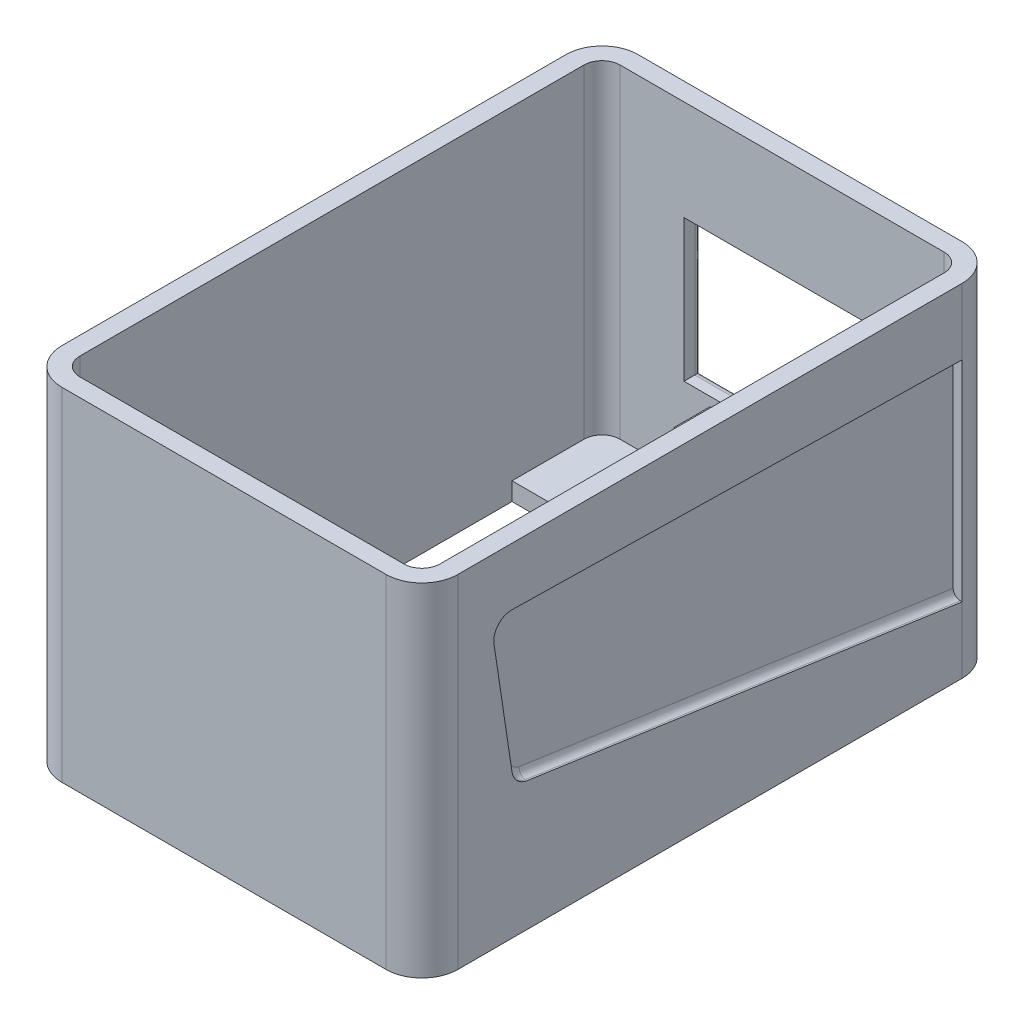
from build123d import *

# Parameters (mm, degrees)
BOSS_EXTRUDE1_DEPTH = 6.35
BOSS_EXTRUDE2_DEPTH = 114.3
SKETCH3_W           = 69.2
SKETCH3_H           = 50
CUT_EXTRUDE1_DEPTH  = 31.71
FILLET1_R           = 2.54
CUT_EXTRUDE2_DEPTH  = 3.175
FILLET2_R           = 2.54
SKETCH8_W           = 50.8
SKETCH8_H           = 6.35
BOSS_EXTRUDE3_DEPTH = 12.7
SKETCH9_W           = 27.302002056
SKETCH9_H           = 3.175
BOSS_EXTRUDE4_DEPTH = 6.35
FILLET4_R           = 2.54
FILLET5_R           = 2.54


with BuildPart() as part:
    # Sketch1 → Boss-Extrude1 (new body)
    with BuildSketch(Plane(origin=(0, 0, 0), x_dir=(1, 0, 0), z_dir=(0, 1, 0))):
        with BuildLine():
            Line((-51.097477477, 62.55608588), (63.202522523, 62.55608588))
            ThreePointArc((63.202522523, 62.55608588), (72.182778644, 58.836342002), (75.902522523, 49.85608588))
            Line((75.902522523, 49.85608588), (75.902522523, -127.94391412))
            ThreePointArc((75.902522523, -127.94391412), (72.182778644, -136.924170241), (63.202522523, -140.64391412))
            Line((63.202522523, -140.64391412), (-51.097477477, -140.64391412))
            ThreePointArc((-51.097477477, -140.64391412), (-60.077733599, -136.924170241), (-63.797477477, -127.94391412))
            Line((-63.797477477, -127.94391412), (-63.797477477, 49.85608588))
            ThreePointArc((-63.797477477, 49.85608588), (-60.077733599, 58.836342002), (-51.097477477, 62.55608588))
        make_face()
        Polygon((-57.447477477, 24.45608588), (-57.447477477, -102.54391412), (-19.347477477, -102.54391412), (-19.347477477, -134.29391412), (31.452522523, -134.29391412), (31.452522523, -102.54391412), (69.552522523, -102.54391412), (69.552522523, 24.45608588), (31.452522523, 24.45608588), (31.452522523, 56.20608588), (-19.347477477, 56.20608588), (-19.347477477, 24.45608588), align=None, mode=Mode.SUBTRACT)
    extrude(amount=BOSS_EXTRUDE1_DEPTH)

    # Sketch2 → Boss-Extrude2 (add)
    with BuildSketch(Plane(origin=(0, 6.35, 0), x_dir=(1, 0, 0), z_dir=(0, 1, 0))):
        with BuildLine():
            Line((75.902522523, -127.94391412), (75.902522523, 49.85608588))
            ThreePointArc((75.902522523, 49.85608588), (72.182778644, 58.836342002), (63.202522523, 62.55608588))
            Line((63.202522523, 62.55608588), (-51.097477477, 62.55608588))
            ThreePointArc((-51.097477477, 62.55608588), (-60.077733599, 58.836342002), (-63.797477477, 49.85608588))
            Line((-63.797477477, 49.85608588), (-63.797477477, -127.94391412))
            ThreePointArc((-63.797477477, -127.94391412), (-60.077733599, -136.924170241), (-51.097477477, -140.64391412))
            Line((-51.097477477, -140.64391412), (63.202522523, -140.64391412))
            ThreePointArc((63.202522523, -140.64391412), (72.182778644, -136.924170241), (75.902522523, -127.94391412))
        make_face()
        with BuildLine():
            Line((69.552522523, -127.94391412), (69.552522523, 49.85608588))
            ThreePointArc((69.552522523, 49.85608588), (67.692650583, 54.346213941), (63.202522523, 56.20608588))
            Line((63.202522523, 56.20608588), (-51.097477477, 56.20608588))
            ThreePointArc((-51.097477477, 56.20608588), (-55.587605538, 54.346213941), (-57.447477477, 49.85608588))
            Line((-57.447477477, 49.85608588), (-57.447477477, -127.94391412))
            ThreePointArc((-57.447477477, -127.94391412), (-55.587605538, -132.43404218), (-51.097477477, -134.29391412))
            Line((-51.097477477, -134.29391412), (63.202522523, -134.29391412))
            ThreePointArc((63.202522523, -134.29391412), (67.692650583, -132.43404218), (69.552522523, -127.94391412))
        make_face(mode=Mode.SUBTRACT)
    extrude(amount=BOSS_EXTRUDE2_DEPTH)

    # Sketch3 → Cut-Extrude1 (cut)
    with BuildSketch(Plane(origin=(0, 0, -62.55608588), x_dir=(-1, 0, 0), z_dir=(0, 0, -1))):
        with Locations((-6.052522523, 60.325)):
            Rectangle(SKETCH3_W, SKETCH3_H)
    extrude(amount=-CUT_EXTRUDE1_DEPTH, mode=Mode.SUBTRACT)

    # Fillet1
    fillet1_edges = [part.edges().sort_by_distance(p)[0] for p in [
        (6.052522523, 85.325, -62.55608588),
        (-28.547477477, 60.325, -62.55608588),
        (40.652522523, 60.325, -62.55608588),
        (6.052522523, 35.325, -62.55608588),
    ]]
    fillet(fillet1_edges, radius=FILLET1_R)

    # Sketch6 → Cut-Extrude2 (cut)
    with BuildSketch(Plane.ZY.offset(63.797477477)):
        with BuildLine():
            Line((-49.85608588, 23.368), (103.519740541, 45.45891847))
            ThreePointArc((103.519740541, 45.45891847), (107.09072322, 47.24008694), (108.89391412, 50.8))
            Line((108.89391412, 50.8), (115.24391412, 93.037110429))
            ThreePointArc((115.24391412, 93.037110429), (113.736824756, 98.170115624), (108.842546446, 100.33))
            Line((108.842546446, 100.33), (-49.85608588, 97.282))
            Line((-49.85608588, 97.282), (-49.85608588, 23.368))
        make_face()
    cut_extrude2 = extrude(amount=-CUT_EXTRUDE2_DEPTH, mode=Mode.SUBTRACT)

    # Fillet2
    fillet2_edges = [part.edges().sort_by_distance(p)[0] for p in [
        (-60.622477477, 98.170115624, 113.736824756),
        (-60.622477477, 71.918555214, 112.06891412),
        (-60.622477477, 47.24008694, 107.09072322),
        (-60.622477477, 34.413459235, 26.83182733),
        (-60.622477477, 60.325, -49.85608588),
        (-60.622477477, 98.806, 29.493230283),
    ]]
    fillet(fillet2_edges, radius=FILLET2_R)

    # Sketch8 → Boss-Extrude3 (add)
    with BuildSketch(Plane.XY.offset(-56.20608588)):
        with Locations((6.052522523, 28.975)):
            Rectangle(SKETCH8_W, SKETCH8_H)
    extrude(amount=BOSS_EXTRUDE3_DEPTH)

    # Sketch9 → Boss-Extrude4 (add)
    with BuildSketch(Plane(origin=(0, 32.15, 0), x_dir=(1, 0, 0), z_dir=(0, 1, 0))):
        with Locations((17.801521495, 45.09358588)):
            Rectangle(SKETCH9_W, SKETCH9_H)
    extrude(amount=BOSS_EXTRUDE4_DEPTH)

    # Fillet4
    fillet4_edges = [part.edges().sort_by_distance(p)[0] for p in [
        (6.052522523, 25.8, -56.20608588),
    ]]
    fillet(fillet4_edges, radius=FILLET4_R)

    # Mirror2: Cut-Extrude2 across plane
    add(cut_extrude2.mirror(Plane(origin=(6.052522523, 0, 0), x_dir=(0, 0, 1), z_dir=(1, 0, 0))), mode=Mode.SUBTRACT)

    # Fillet5
    fillet5_edges = [part.edges().sort_by_distance(p)[0] for p in [
        (72.727522523, 98.170115624, 113.736824756),
        (72.727522523, 98.806, 29.493230283),
        (72.727522523, 34.413459235, 26.83182733),
        (72.727522523, 47.24008694, 107.09072322),
        (72.727522523, 71.918555214, 112.06891412),
    ]]
    fillet(fillet5_edges, radius=FILLET5_R)


solid = part.part
